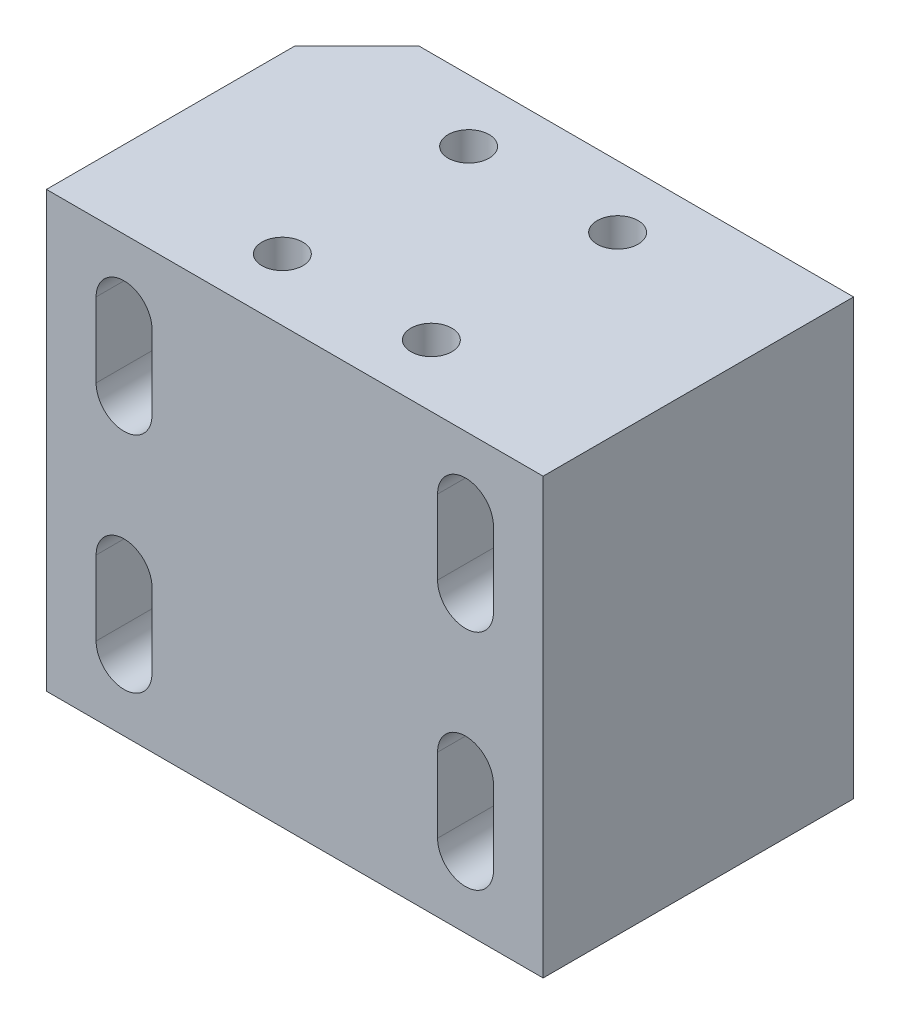
from build123d import *

# Parameters (mm, degrees)
SKETCH1_W                                            = 40
SKETCH1_H                                            = 35
BOSS_EXTRUDE1_DEPTH                                  = 25
CHAMFER1_SIZE                                        = 5
CBORE_FOR_M4_HEXAGON_SOCKET_HEAD_CAP_SCR_D           = 4.5
CBORE_FOR_M4_HEXAGON_SOCKET_HEAD_CAP_SCR_CBORE_D     = 8
CBORE_FOR_M4_HEXAGON_SOCKET_HEAD_CAP_SCR_CBORE_DEPTH = 18
CUT_EXTRUDE1_DEPTH                                   = 33.097507691
CUT_EXTRUDE2_DEPTH                                   = 33.097507691
M4_TAPPED_HOLE1_D                                    = 3.3


with BuildPart() as part:
    # Sketch1 → Boss-Extrude1 (new body)
    with BuildSketch(Plane.XY):
        Rectangle(SKETCH1_W, SKETCH1_H)
    extrude(amount=BOSS_EXTRUDE1_DEPTH)

    # Chamfer1
    chamfer1_edges = [part.edges().sort_by_distance(p)[0] for p in [
        (-20, 0, 0),
    ]]
    chamfer(chamfer1_edges, length=CHAMFER1_SIZE)

    # CBORE for M4 Hexagon socket head cap screws1 (through all)
    with Locations(Plane(origin=(0, 0, 0), x_dir=(-1, 0, 0), z_dir=(0, 0, -1))):
        with Locations((-13.75, 9), (-13.75, -9), (13.75, -9), (13.75, 9)):
            CounterBoreHole(CBORE_FOR_M4_HEXAGON_SOCKET_HEAD_CAP_SCR_D / 2, CBORE_FOR_M4_HEXAGON_SOCKET_HEAD_CAP_SCR_CBORE_D / 2, CBORE_FOR_M4_HEXAGON_SOCKET_HEAD_CAP_SCR_CBORE_DEPTH)

    # Sketch5 → Cut-Extrude1 (cut, through all)
    with BuildSketch(Plane(origin=(0, 0, 18), x_dir=(-1, 0, 0), z_dir=(0, 0, -1))):
        with BuildLine():
            Line((-9.75, 12), (-9.75, 6))
            ThreePointArc((-9.75, 6), (-13.75, 2), (-17.75, 6))
            Line((-17.75, 6), (-17.75, 12))
            ThreePointArc((-17.75, 12), (-13.75, 16), (-9.75, 12))
        make_face()
        with BuildLine():
            Line((-9.75, -12), (-9.75, -6))
            ThreePointArc((-9.75, -6), (-13.75, -2), (-17.75, -6))
            Line((-17.75, -6), (-17.75, -12))
            ThreePointArc((-17.75, -12), (-13.75, -16), (-9.75, -12))
        make_face()
        with BuildLine():
            Line((9.75, 12), (9.75, 6))
            ThreePointArc((9.75, 6), (13.75, 2), (17.75, 6))
            Line((17.75, 6), (17.75, 12))
            ThreePointArc((17.75, 12), (13.75, 16), (9.75, 12))
        make_face()
        with BuildLine():
            Line((9.75, -12), (9.75, -6))
            ThreePointArc((9.75, -6), (13.75, -2), (17.75, -6))
            Line((17.75, -6), (17.75, -12))
            ThreePointArc((17.75, -12), (13.75, -16), (9.75, -12))
        make_face()
    extrude(amount=CUT_EXTRUDE1_DEPTH, mode=Mode.SUBTRACT)

    # Sketch6 → Cut-Extrude2 (cut, through all)
    with BuildSketch(Plane(origin=(0, 0, 18), x_dir=(-1, 0, 0), z_dir=(0, 0, -1))):
        with BuildLine():
            Line((-11.5, 12), (-11.5, 6))
            ThreePointArc((-11.5, 6), (-13.75, 3.75), (-16, 6))
            Line((-16, 6), (-16, 12))
            ThreePointArc((-16, 12), (-13.75, 14.25), (-11.5, 12))
        make_face()
        with BuildLine():
            Line((11.5, 12), (11.5, 6))
            ThreePointArc((11.5, 6), (13.75, 3.75), (16, 6))
            Line((16, 6), (16, 12))
            ThreePointArc((16, 12), (13.75, 14.25), (11.5, 12))
        make_face()
        with BuildLine():
            Line((-11.5, -12), (-11.5, -6))
            ThreePointArc((-11.5, -6), (-13.75, -3.75), (-16, -6))
            Line((-16, -6), (-16, -12))
            ThreePointArc((-16, -12), (-13.75, -14.25), (-11.5, -12))
        make_face()
        with BuildLine():
            Line((11.5, -12), (11.5, -6))
            ThreePointArc((11.5, -6), (13.75, -3.75), (16, -6))
            Line((16, -6), (16, -12))
            ThreePointArc((16, -12), (13.75, -14.25), (11.5, -12))
        make_face()
    extrude(amount=-CUT_EXTRUDE2_DEPTH, mode=Mode.SUBTRACT)

    # M4 Tapped Hole1 (through all)
    with Locations(Plane(origin=(0, 17.5, 0), x_dir=(1, 0, 0), z_dir=(0, 1, 0))):
        with Locations((-6, -5), (-6, -20), (6, -20), (6, -5)):
            Hole(M4_TAPPED_HOLE1_D / 2)


solid = part.part
